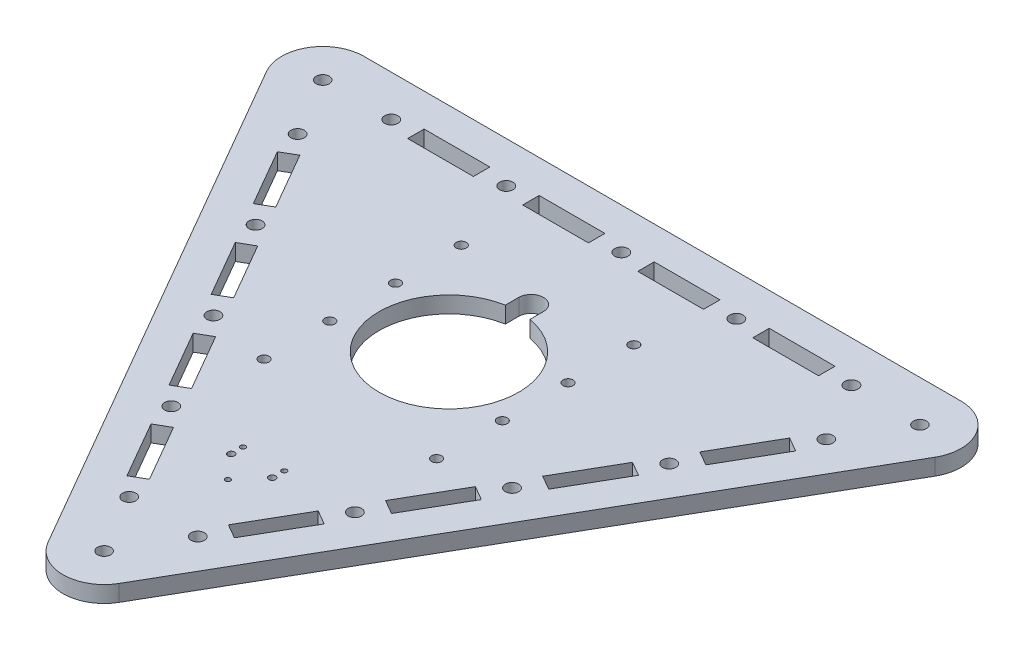
from build123d import *

# Parameters (mm, degrees)
BOSS_EXTRUDE1_DEPTH = 10
SKETCH2_R           = 3.05
CUT_EXTRUDE1_DEPTH  = 344.838624939
FILLET1_R           = 25
SKETCH3_R           = 4
CUT_EXTRUDE2_DEPTH  = 313.983999349
SKETCH4_R           = 4.05
SKETCH4_W           = 40
SKETCH4_H           = 10
CUT_EXTRUDE3_DEPTH  = 313.983999349
CIRPATTERN1_COUNT   = 3
SKETCH7_R           = 2.05
SKETCH7_R_2         = 1.55
CUT_EXTRUDE4_DEPTH  = 313.983999349
SKETCH8_R           = 42.5
CUT_EXTRUDE5_DEPTH  = 313.983999349


with BuildPart() as part:
    # Sketch1 → Boss-Extrude1 (new body)
    with BuildSketch(Plane(origin=(0, 0, 0), x_dir=(1, 0, 0), z_dir=(0, 1, 0))):
        Polygon((0, -259.807621135), (225, 129.903810568), (-225, 129.903810568), align=None)
    extrude(amount=BOSS_EXTRUDE1_DEPTH)

    # Sketch2 → Cut-Extrude1 (cut, through all)
    with BuildSketch(Plane(origin=(0, 10, 0), x_dir=(1, 0, 0), z_dir=(0, 1, 0))):
        with Locations(Location((-52.5, 60, 0), (0, 0, 270))):
            Circle(SKETCH2_R)
        with Locations(Location((-52.5, -60, 0), (0, 0, 270))):
            Circle(SKETCH2_R)
        with Locations(Location((-52.5, -20, 0), (0, 0, 270))):
            Circle(SKETCH2_R)
        with Locations(Location((-52.5, 20, 0), (0, 0, 270))):
            Circle(SKETCH2_R)
    cut_extrude1 = extrude(amount=-CUT_EXTRUDE1_DEPTH, mode=Mode.SUBTRACT)

    # Mirror1: Cut-Extrude1 across plane
    add(cut_extrude1.mirror(Plane(origin=(0, 0, 0), x_dir=(0, 0, 1), z_dir=(1, 0, 0))), mode=Mode.SUBTRACT)

    # Fillet1
    fillet1_edges = [part.edges().sort_by_distance(p)[0] for p in [
        (-225, 5, -129.903810568),
        (225, 5, -129.903810568),
        (0, 5, 259.807621135),
    ]]
    fillet(fillet1_edges, radius=FILLET1_R)

    # Sketch3 → Cut-Extrude2 (cut, through all)
    with BuildSketch(Plane(origin=(0, 10, 0), x_dir=(1, 0, 0), z_dir=(0, 1, 0))):
        with Locations(Location((0, -209.807621135, 0), (0, 0, 270))):
            Circle(SKETCH3_R)
        with Locations(Location((181.698729811, 104.903810568, 0), (0, 0, 270))):
            Circle(SKETCH3_R)
        with Locations(Location((-181.698729811, 104.903810568, 0), (0, 0, 270))):
            Circle(SKETCH3_R)
    extrude(amount=-CUT_EXTRUDE2_DEPTH, mode=Mode.SUBTRACT)

    # Sketch4 → Cut-Extrude3 (cut, through all)
    with BuildSketch(Plane(origin=(0, 10, 0), x_dir=(1, 0, 0), z_dir=(0, 1, 0))):
        with Locations(Location((0, 104.903810568, 0), (0, 0, 270))):
            Circle(SKETCH4_R)
        with Locations(Location((70, 104.903810568, 0), (0, 0, 270))):
            Circle(SKETCH4_R)
        with Locations(Location((140, 104.903810568, 0), (0, 0, 270))):
            Circle(SKETCH4_R)
        with Locations(Location((-140, 104.903810568, 0), (0, 0, 270))):
            Circle(SKETCH4_R)
        with Locations(Location((-70, 104.903810568, 0), (0, 0, 270))):
            Circle(SKETCH4_R)
        with Locations((35, 104.903810568)):
            Rectangle(SKETCH4_W, SKETCH4_H)
        with Locations((-35, 104.903810568)):
            Rectangle(SKETCH4_W, SKETCH4_H)
        with Locations((-105, 104.903810568)):
            Rectangle(SKETCH4_W, SKETCH4_H)
        with Locations((105, 104.903810568)):
            Rectangle(SKETCH4_W, SKETCH4_H)
    cut_extrude3 = extrude(amount=-CUT_EXTRUDE3_DEPTH, mode=Mode.SUBTRACT)

    # CirPattern1: Cut-Extrude3 ×3 about axis
    cirpattern1_axis = Axis((0, 0, 0), (0, 1, 0))
    for i in range(1, CIRPATTERN1_COUNT):
        add(cut_extrude3.rotate(cirpattern1_axis, i * 360 / CIRPATTERN1_COUNT), mode=Mode.SUBTRACT)

    # Sketch7 → Cut-Extrude4 (cut, through all)
    with BuildSketch(Plane(origin=(0, 10, 0), x_dir=(1, 0, 0), z_dir=(0, 1, 0))):
        with Locations(Location((-12.5, -120, 0), (0, 0, 270))):
            Circle(SKETCH7_R)
        with Locations(Location((12.5, -120, 0), (0, 0, 270))):
            Circle(SKETCH7_R)
        with Locations(Location((-12.557368355, -112.75, 0), (0, 0, 270))):
            Circle(SKETCH7_R_2)
        with Locations(Location((0, -134.5, 0), (0, 0, 270))):
            Circle(SKETCH7_R_2)
        with Locations(Location((12.557368355, -112.75, 0), (0, 0, 270))):
            Circle(SKETCH7_R_2)
    extrude(amount=-CUT_EXTRUDE4_DEPTH, mode=Mode.SUBTRACT)

    # Sketch8 → Cut-Extrude5 (cut, through all)
    with BuildSketch(Plane(origin=(0, 10, 0), x_dir=(1, 0, 0), z_dir=(0, 1, 0))):
        Circle(SKETCH8_R)
        with BuildLine():
            Line((-7.5, 35), (-7.5, 50))
            ThreePointArc((-7.5, 50), (0, 57.5), (7.5, 50))
            Line((7.5, 50), (7.5, 35))
            ThreePointArc((7.5, 35), (0, 27.5), (-7.5, 35))
        make_face()
    extrude(amount=-CUT_EXTRUDE5_DEPTH, mode=Mode.SUBTRACT)


solid = part.part
